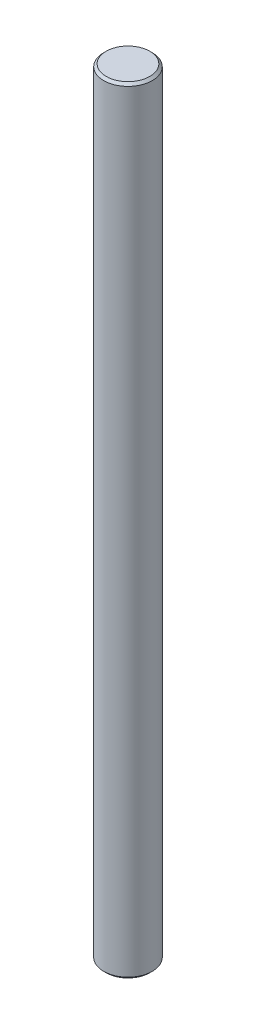
from build123d import *

# Parameters (mm, degrees)
SKETCH1_R           = 2.5
BOSS_EXTRUDE1_DEPTH = 40
CHAMFER1_SIZE       = 0.25


with BuildPart() as part:
    # Sketch1 → Boss-Extrude1 (new, symmetric)
    with BuildSketch(Plane(origin=(0, 0, 0), x_dir=(1, 0, 0), z_dir=(0, 1, 0))):
        with Locations(Location((0, 0, 0), (0, 0, 270))):
            Circle(SKETCH1_R)
    extrude(amount=BOSS_EXTRUDE1_DEPTH, both=True)

    # Chamfer1
    chamfer1_edges = [part.edges().sort_by_distance(p)[0] for p in [
        (0, -40, -2.5),
        (0, 40, -2.5),
    ]]
    chamfer(chamfer1_edges, length=CHAMFER1_SIZE)


solid = part.part
